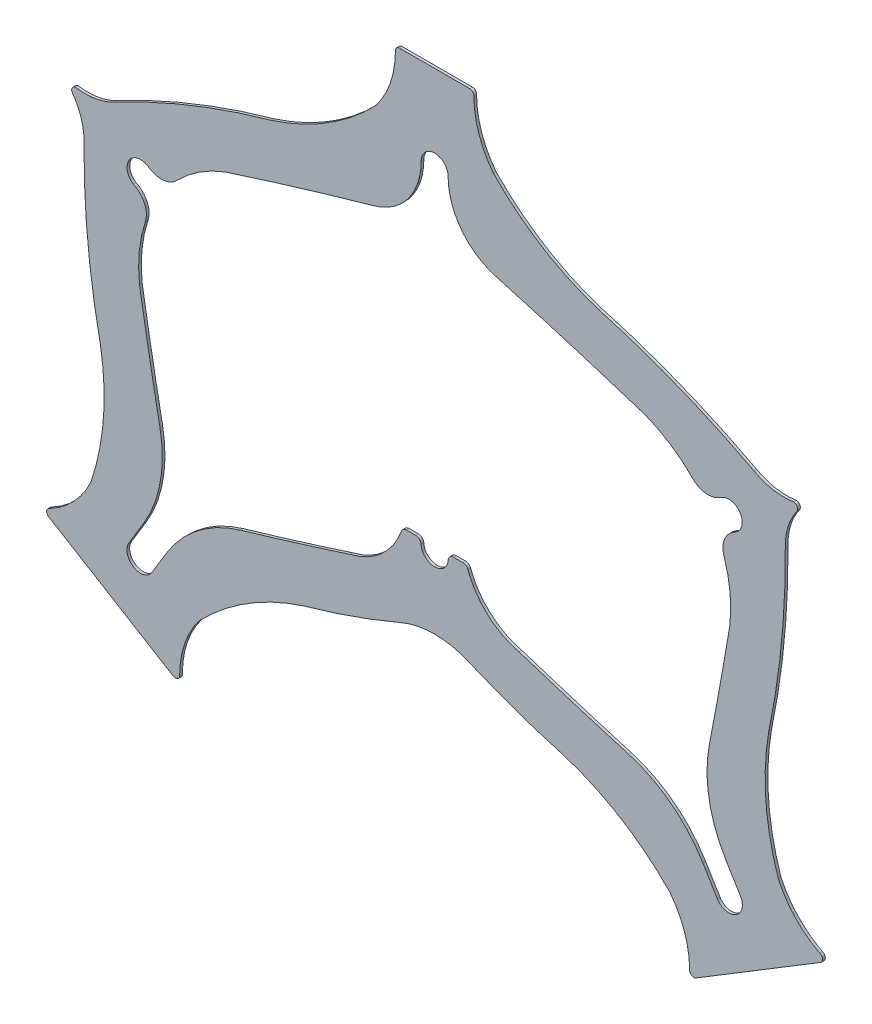
from build123d import *

# Parameters (mm, degrees)
BOSS_EXTRUDE1_DEPTH = 6.35


with BuildPart() as part:
    # Model → Boss-Extrude1 (new body)
    with BuildSketch(Plane.XY):
        with BuildLine():
            Line((4.731109074, 179.975171138), (151.543552764, 90.714118443))
            Line((151.543552764, 90.714118443), (298.355996454, 1.453065748))
            ThreePointArc((298.355996454, 1.453065748), (309.25405907, 1.773353837), (313.400175898, 11.857007366))
            ThreePointArc((313.400175898, 11.857007366), (325.499817287, 82.291618906), (359.548910429, 145.125487805))
            ThreePointArc((359.548910429, 145.125487805), (378.530992835, 164.009725995), (398.349908157, 182.013739434))
            ThreePointArc((398.349908157, 182.013739434), (496.609924919, 251.106758089), (606.822390935, 298.877967575))
            ThreePointArc((606.822390935, 298.877967575), (722.465722657, 335.316646957), (835.462841761, 379.280366099))
            ThreePointArc((835.462841761, 379.280366099), (874.182548891, 391.364362796), (914.542928671, 395.39901772))
            ThreePointArc((914.542928671, 395.39901772), (954.903308451, 391.364362796), (993.62301558, 379.280366099))
            ThreePointArc((993.62301558, 379.280366099), (1106.620134686, 335.316646956), (1222.26346641, 298.877967574))
            ThreePointArc((1222.26346641, 298.877967574), (1332.475932423, 251.106758088), (1430.735949184, 182.013739434))
            ThreePointArc((1430.735949184, 182.013739434), (1450.554864506, 164.009725995), (1469.536946912, 145.125487805))
            ThreePointArc((1469.536946912, 145.125487805), (1503.586040054, 82.291618906), (1515.685681443, 11.857007366))
            ThreePointArc((1515.685681443, 11.857007366), (1519.831798271, 1.773353837), (1530.729860887, 1.453065748))
            Line((1530.729860887, 1.453065748), (1677.542304577, 90.714118443))
            Line((1677.542304577, 90.714118443), (1824.354748267, 179.975171138))
            ThreePointArc((1824.354748267, 179.975171138), (1829.085903545, 189.797926504), (1822.041714251, 198.119569997))
            ThreePointArc((1822.041714251, 198.119569997), (1765.078027346, 241.277120886), (1724.963897376, 300.423485114))
            ThreePointArc((1724.963897376, 300.423485114), (1695.433102398, 444.147036942), (1702.261958811, 590.714065711))
            ThreePointArc((1702.261958811, 590.714065711), (1732.268416352, 786.388398141), (1741.114180038, 984.152359294))
            ThreePointArc((1741.114180038, 984.152359294), (1747.638220475, 1031.694941858), (1769.415270954, 1074.457312383))
            ThreePointArc((1769.415270954, 1074.457312383), (1770.281785592, 1079.18754246), (1768.843236262, 1083.776278673))
            ThreePointArc((1768.843236262, 1083.776278673), (1765.431383684, 1087.165258783), (1760.833075168, 1088.572910369))
            ThreePointArc((1760.833075168, 1088.572910369), (1712.84619872, 1088.919247204), (1667.635170438, 1105.00722974))
            ThreePointArc((1667.635170438, 1105.00722974), (1487.988377024, 1188.168888466), (1300.458187217, 1251.582292231))
            ThreePointArc((1300.458187217, 1251.582292231), (1190.245721199, 1299.353501718), (1091.985704435, 1368.446520373))
            ThreePointArc((1091.985704435, 1368.446520373), (1072.166789113, 1386.450533813), (1053.184706708, 1405.334772002))
            ThreePointArc((1053.184706708, 1405.334772002), (1019.135613566, 1468.168640901), (1007.035972176, 1538.603252442))
            ThreePointArc((1007.035972176, 1538.603252442), (1004.900450409, 1546.845116579), (997.194061205, 1550.464556193))
            Line((997.194061205, 1550.464556193), (914.542928671, 1550.464556193))
            Line((914.542928671, 1550.464556193), (831.891796136, 1550.464556193))
            ThreePointArc((831.891796136, 1550.464556193), (824.185406932, 1546.845116579), (822.049885165, 1538.603252442))
            ThreePointArc((822.049885165, 1538.603252442), (809.950243775, 1468.168640901), (775.901150633, 1405.334772002))
            ThreePointArc((775.901150633, 1405.334772002), (756.919068228, 1386.450533813), (737.100152906, 1368.446520373))
            ThreePointArc((737.100152906, 1368.446520373), (638.840136142, 1299.353501718), (528.627670124, 1251.582292231))
            ThreePointArc((528.627670124, 1251.582292231), (341.097480319, 1188.168888466), (161.450686905, 1105.007229742))
            ThreePointArc((161.450686905, 1105.007229742), (116.239658622, 1088.919247204), (68.252782173, 1088.572910369))
            ThreePointArc((68.252782173, 1088.572910369), (63.654473657, 1087.165258783), (60.242621079, 1083.776278673))
            ThreePointArc((60.242621079, 1083.776278673), (58.804071749, 1079.18754246), (59.670586387, 1074.457312383))
            ThreePointArc((59.670586387, 1074.457312383), (81.447636866, 1031.694941858), (87.971677303, 984.152359294))
            ThreePointArc((87.971677303, 984.152359294), (96.817440989, 786.388398141), (126.82389853, 590.714065711))
            ThreePointArc((126.82389853, 590.714065711), (133.652754943, 444.147036942), (104.121959965, 300.423485114))
            ThreePointArc((104.121959965, 300.423485114), (64.007829995, 241.277120886), (7.04414309, 198.119569997))
            ThreePointArc((7.04414309, 198.119569997), (-4.6204e-05, 189.797926504), (4.731109074, 179.975171138))
        make_face()
        with BuildLine():
            ThreePointArc((248.036389916, 188.305700503), (204.412712542, 177.670862829), (193.777874867, 221.294540203))
            Line((193.777874867, 221.294540203), (228.097625685, 277.742076191))
            ThreePointArc((228.097625685, 277.742076191), (267.717827548, 382.549812212), (266.789374301, 494.592482209))
            ThreePointArc((266.789374301, 494.592482209), (241.770965978, 627.59734054), (218.673506786, 760.949207694))
            ThreePointArc((218.673506786, 760.949207694), (218.167687021, 829.167165589), (232.404753167, 895.884866243))
            ThreePointArc((232.404753167, 895.884866243), (231.841152746, 929.369079724), (210.559765814, 955.226627329))
            Line((210.559765814, 955.226627329), (204.638979738, 958.826428441))
            ThreePointArc((204.638979738, 958.826428441), (194.004142064, 1002.450105815), (237.627819438, 1013.084943489))
            Line((237.627819438, 1013.084943489), (243.548605514, 1009.485142378))
            ThreePointArc((243.548605514, 1009.485142378), (276.299184629, 1002.491590666), (306.286010429, 1017.401335007))
            ThreePointArc((306.286010429, 1017.401335007), (358.96611995, 1060.745904377), (419.763138988, 1091.692117541))
            ThreePointArc((419.763138988, 1091.692117541), (595.228682895, 1146.768807529), (771.739960804, 1198.39600627))
            ThreePointArc((771.739960804, 1198.39600627), (851.898170732, 1253.089548855), (882.79292867, 1345.079962222))
            Line((882.79292867, 1345.079962222), (882.79292867, 1345.660139454))
            ThreePointArc((882.79292867, 1345.660139454), (892.092288368, 1368.110779757), (914.542928671, 1377.410139455))
            ThreePointArc((914.542928671, 1377.410139455), (936.993568973, 1368.110779757), (946.292928671, 1345.660139454))
            Line((946.292928671, 1345.660139454), (946.292928671, 1345.079962222))
            ThreePointArc((946.292928671, 1345.079962222), (977.187686609, 1253.089548855), (1057.345896537, 1198.39600627))
            ThreePointArc((1057.345896537, 1198.39600627), (1233.857174446, 1146.768807529), (1409.322718353, 1091.692117541))
            ThreePointArc((1409.322718353, 1091.692117541), (1470.119737391, 1060.745904377), (1522.799846912, 1017.401335006))
            ThreePointArc((1522.799846912, 1017.401335006), (1552.786672713, 1002.491590666), (1585.537251828, 1009.485142378))
            Line((1585.537251828, 1009.485142378), (1591.458037903, 1013.084943489))
            ThreePointArc((1591.458037903, 1013.084943489), (1635.081715277, 1002.450105815), (1624.446877603, 958.826428441))
            Line((1624.446877603, 958.826428441), (1618.526091527, 955.226627329))
            ThreePointArc((1618.526091527, 955.226627329), (1597.244704595, 929.369079725), (1596.681104174, 895.884866243))
            ThreePointArc((1596.681104174, 895.884866243), (1610.91817032, 829.167165589), (1610.412350555, 760.949207694))
            ThreePointArc((1610.412350555, 760.949207694), (1587.314891364, 627.597340544), (1562.296483041, 494.592482218))
            ThreePointArc((1562.296483041, 494.592482218), (1561.368029793, 382.549812216), (1600.988231656, 277.742076191))
            Line((1600.988231656, 277.742076191), (1635.307982474, 221.294540203))
            ThreePointArc((1635.307982474, 221.294540203), (1624.673144799, 177.670862829), (1581.049467425, 188.305700503))
            Line((1581.049467425, 188.305700503), (1546.729716607, 244.753236491))
            ThreePointArc((1546.729716607, 244.753236491), (1471.914922649, 328.162879411), (1372.015609312, 378.902894406))
            ThreePointArc((1372.015609312, 378.902894406), (1242.41928054, 417.90295417), (1113.398935267, 458.768142267))
            ThreePointArc((1113.398935267, 458.768142267), (1039.69925486, 497.387302002), (993.069617081, 566.298543982))
            ThreePointArc((993.069617081, 566.298543982), (988.420625685, 572.364700975), (981.132076965, 574.664361651))
            Line((981.132076965, 574.664361651), (959.146552953, 574.664361651))
            ThreePointArc((959.146552953, 574.664361651), (950.426671687, 571.197653085), (946.467308072, 562.690136563))
            ThreePointArc((946.467308072, 562.690136563), (936.486383713, 541.343696224), (914.542586541, 532.755382542))
            ThreePointArc((914.542586541, 532.755382542), (892.599225651, 541.343933359), (882.618549269, 562.690136563))
            ThreePointArc((882.618549269, 562.690136563), (878.659185654, 571.197653084), (869.939304388, 574.664361651))
            Line((869.939304388, 574.664361651), (847.953780376, 574.664361651))
            ThreePointArc((847.953780376, 574.664361651), (840.665231667, 572.364700959), (836.01624026, 566.298543983))
            ThreePointArc((836.01624026, 566.298543983), (789.386602481, 497.387302002), (715.686922074, 458.768142267))
            ThreePointArc((715.686922074, 458.768142267), (586.666576793, 417.902954168), (457.070248014, 378.902894401))
            ThreePointArc((457.070248014, 378.902894401), (357.170934686, 328.162879406), (282.356140734, 244.753236492))
            Line((282.356140734, 244.753236492), (248.036389916, 188.305700503))
        make_face(mode=Mode.SUBTRACT)
    extrude(amount=BOSS_EXTRUDE1_DEPTH)


solid = part.part
